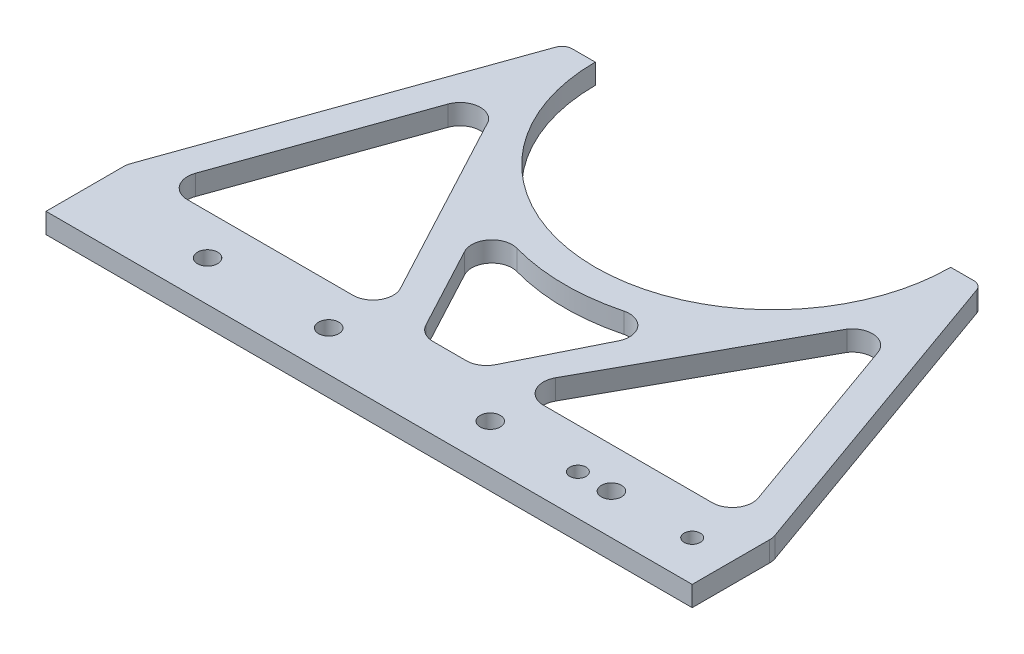
from build123d import *

# Parameters (mm, degrees)
SKETCH1_R              = 3.175
BOSS_EXTRUDE1_DEPTH    = 6.35
FILLET1_R              = 3.175
F_10_CLEARANCE_HOLE1_D = 5.1054


with BuildPart() as part:
    # Sketch1 → Boss-Extrude1 (new body)
    with BuildSketch(Plane(origin=(0, 0, 0), x_dir=(1, 0, 0), z_dir=(0, 1, 0))):
        with BuildLine():
            ThreePointArc((55.88, 63.5), (0, 7.62), (-55.88, 63.5))
            Line((-55.88, 63.5), (-65.405, 63.5))
            Line((-65.405, 63.5), (-101.231750934, -37.066318412))
            ThreePointArc((-101.231750934, -37.066318412), (-101.50726052, -38.116025925), (-101.6, -39.197317183))
            Line((-101.6, -39.197317183), (-101.6, -63.5))
            Line((-101.6, -63.5), (101.6, -63.5))
            Line((101.6, -63.5), (101.6, -39.197317183))
            ThreePointArc((101.6, -39.197317183), (101.50726052, -38.116025925), (101.231750934, -37.066318412))
            Line((101.231750934, -37.066318412), (65.405, 63.5))
            Line((65.405, 63.5), (55.88, 63.5))
        make_face()
        with Locations(Location((-63.5, -50.8, 0), (0, 0, 270))):
            Circle(SKETCH1_R, mode=Mode.SUBTRACT)
        with Locations(Location((-25.4, -50.8, 0), (0, 0, 270))):
            Circle(SKETCH1_R, mode=Mode.SUBTRACT)
        with BuildLine():
            Line((-30.492459165, -38.1), (-82.485514384, -38.1))
            ThreePointArc((-82.485514384, -38.1), (-87.67465411, -35.409962965), (-88.467265319, -29.61900123))
            Line((-88.467265319, -29.61900123), (-67.620951247, 28.896968093))
            ThreePointArc((-67.620951247, 28.896968093), (-62.60882158, 33.04150393), (-56.579551543, 30.602954379))
            Line((-56.579551543, 30.602954379), (-24.890648803, -28.759645393))
            ThreePointArc((-24.890648803, -28.759645393), (-25.046761241, -35.016018084), (-30.492459165, -38.1))
        make_face(mode=Mode.SUBTRACT)
        with BuildLine():
            ThreePointArc((-5.299041163, -38.1), (-8.565059247, -37.195697924), (-10.900851525, -34.740354607))
            Line((-10.900851525, -34.740354607), (-24.84623891, -8.616557995))
            ThreePointArc((-24.84623891, -8.616557995), (-24.197984845, -1.653196967), (-17.541381774, 0.491159744))
            ThreePointArc((-17.541381774, 0.491159744), (-0.588821605, -1.902349454), (16.404084946, 0.185546499))
            ThreePointArc((16.404084946, 0.185546499), (22.928583423, -1.961591642), (23.68255589, -8.788802499))
            Line((23.68255589, -8.788802499), (10.859081809, -34.577314678))
            ThreePointArc((10.859081809, -34.577314678), (8.517567892, -37.14796018), (5.173240471, -38.1))
            Line((5.173240471, -38.1), (-5.299041163, -38.1))
        make_face(mode=Mode.SUBTRACT)
        with Locations(Location((25.4, -50.8, 0), (0, 0, 270))):
            Circle(SKETCH1_R, mode=Mode.SUBTRACT)
        with Locations(Location((63.5, -50.8, 0), (0, 0, 270))):
            Circle(SKETCH1_R, mode=Mode.SUBTRACT)
        with BuildLine():
            Line((67.620951247, 28.896968093), (88.467265319, -29.61900123))
            ThreePointArc((88.467265319, -29.61900123), (87.67465411, -35.409962965), (82.485514384, -38.1))
            Line((82.485514384, -38.1), (29.423726477, -38.1))
            ThreePointArc((29.423726477, -38.1), (23.956198754, -34.979340583), (23.862621229, -28.684611212))
            Line((23.862621229, -28.684611212), (56.428690976, 30.395444829))
            ThreePointArc((56.428690976, 30.395444829), (62.481851802, 33.059810636), (67.620951247, 28.896968093))
        make_face(mode=Mode.SUBTRACT)
    extrude(amount=BOSS_EXTRUDE1_DEPTH)

    # Fillet1
    fillet1_edges = [part.edges().sort_by_distance(p)[0] for p in [
        (-65.405, 3.175, -63.5),
        (65.405, 3.175, -63.5),
    ]]
    fillet(fillet1_edges, radius=FILLET1_R)

    # #10 Clearance Hole1 (through all)
    with Locations(Plane(origin=(0, 6.35, 0), x_dir=(1, 0, 0), z_dir=(0, 1, 0))):
        with Locations((52.959, -50.8), (88.9, -50.8)):
            Hole(F_10_CLEARANCE_HOLE1_D / 2)


solid = part.part
